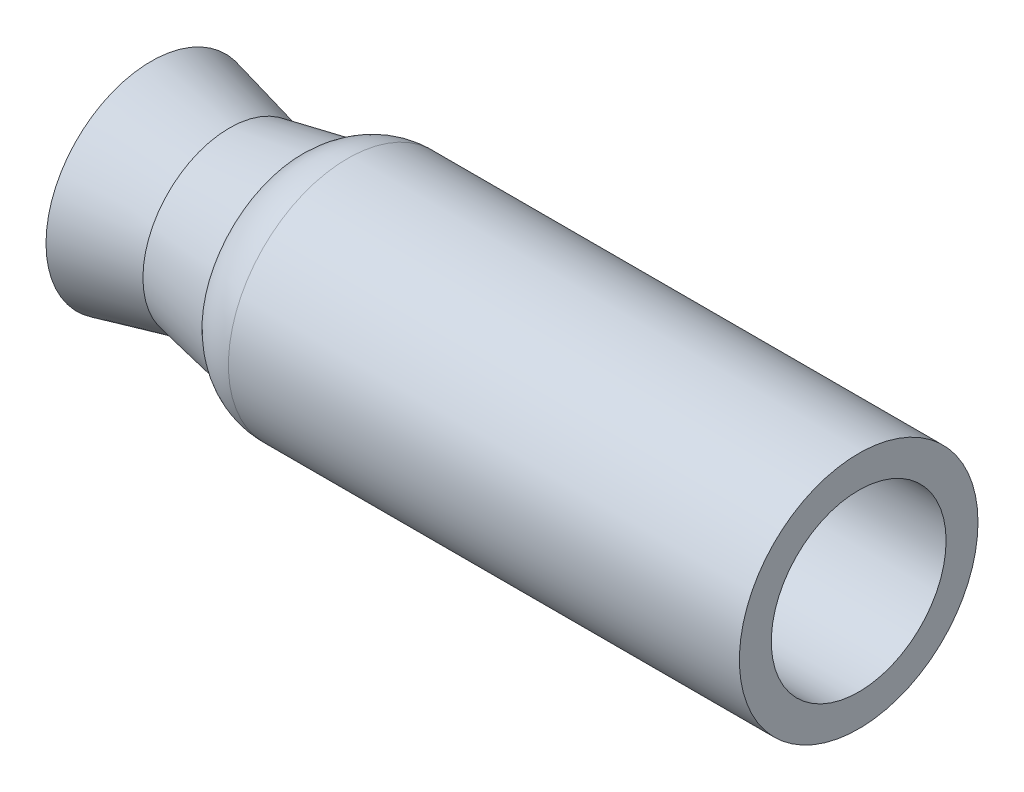
from build123d import *


with BuildPart() as part:
    # Sketch1 → Revolve1 (revolve)
    with BuildSketch(Plane.XY, mode=Mode.PRIVATE) as revolve1_sk:
        with BuildLine():
            Line((52.322643444, 27.400944548), (-107.862323025, 27.400944548))
            ThreePointArc((-107.862323025, 27.400944548), (-111.689157349, 26.639739873), (-114.933390837, 24.47201236))
            Line((-114.933390837, 24.47201236), (-143.633390837, 18.950120538))
            Line((-143.633390837, 18.950120538), (-143.633390837, 14.210120538))
            Line((-143.633390837, 14.210120538), (-144.933390837, 14.7))
            add(Edge.make_bspline(
                [(-171.933390837, 23.283456642), (-158.435473315, 19.858823042), (-144.933390837, 14.7)],
                knots=[0, 0, 0, 1, 1, 1], degree=2))
            Line((-171.933390837, 23.283456642), (-169.474152094, 32.976348099))
            Line((-169.474152094, 32.976348099), (-144.933390837, 27.131544172))
            Line((-144.933390837, 27.131544172), (-122.004458649, 31.543080172))
            ThreePointArc((-122.004458649, 31.543080172), (-115.515991673, 35.878535198), (-107.862323025, 37.400944548))
            Line((-107.862323025, 37.400944548), (52.322643444, 37.400944548))
            Line((52.322643444, 37.400944548), (52.322643444, 27.400944548))
        make_face()
    revolve(revolve1_sk.sketch.rotate(Axis((0, 0, 0), (-1, 0, 0)), 90), axis=Axis((0, 0, 0), (-1, 0, 0)))


solid = part.part
